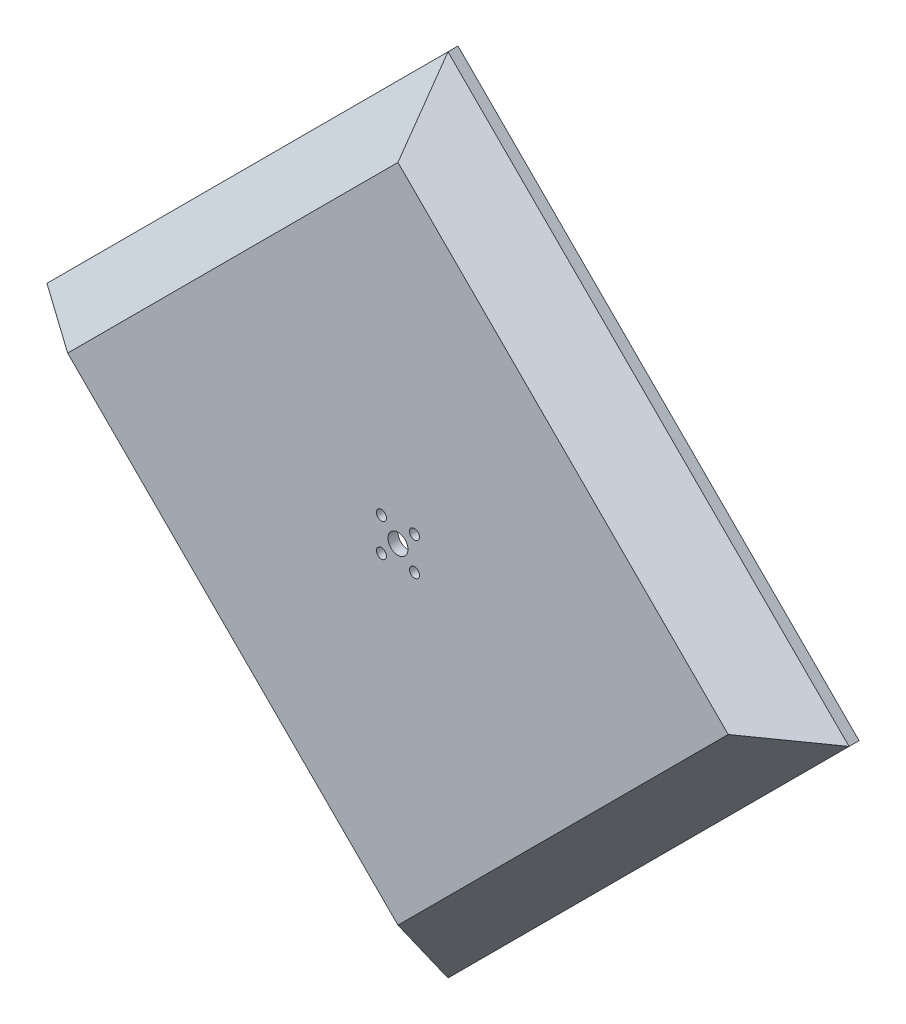
from build123d import *

# Parameters (mm, degrees)
SKETCH_1_W               = 170
SKETCH_1_H               = 170
EXTRUDE_1_DEPTH          = 3
SKETCH_3_R               = 3
SKETCH_3_R_2             = 1.5
CUT_EXTRUDE_1_DEPTH      = 121.245582039
FILLET_1_R               = 2
CUT_EXTRUDE_START        = -10
CUT_EXTRUDE_2_DEPTH      = 10
CUT_EXTRUDE_START_2      = -3
CUT_EXTRUDE_3_DEPTH      = 3
EXTRUDE_4_DEPTH          = 3
EXTRUDE_5_DEPTH          = 170
PATTERN_CIRCULAR_1_COUNT = 4
CUT_EXTRUDE_4_DEPTH      = 179
PATTERN_CIRCULAR_2_COUNT = 4


with BuildPart() as part:
    # 草图1 → 凸台-拉伸1 (new body)
    with BuildSketch(Plane.XY):
        Rectangle(SKETCH_1_W, SKETCH_1_H)
    extrude(amount=EXTRUDE_1_DEPTH)

    # 草图3 → 切除-拉伸1 (cut, through all)
    with BuildSketch(Plane(origin=(0, 0, 0), x_dir=(-1, 0, 0), z_dir=(0, 0, -1))):
        Circle(SKETCH_3_R)
        with Locations((4.95, 4.95)):
            Circle(SKETCH_3_R_2)
        with Locations((-4.95, 4.95)):
            Circle(SKETCH_3_R_2)
        with Locations((-4.95, -4.95)):
            Circle(SKETCH_3_R_2)
        with Locations((4.95, -4.95)):
            Circle(SKETCH_3_R_2)
    extrude(amount=-CUT_EXTRUDE_1_DEPTH, mode=Mode.SUBTRACT)

    # 圆角1
    fillet_1_edges = [part.edges().sort_by_distance(p)[0] for p in [
        (-85, 85, 1.5),
        (85, 85, 1.5),
        (85, -85, 1.5),
        (-85, -85, 1.5),
    ]]
    fillet(fillet_1_edges, radius=FILLET_1_R)

    # 草图4 → 切除-拉伸2 (cut)
    with BuildSketch(Plane(origin=(0, 0, 0), x_dir=(-1, 0, 0), z_dir=(0, 0, -1)).offset(CUT_EXTRUDE_START)):
        with BuildLine():
            Line((-85, 35.208152802), (-60.104076401, 60.104076401))
            Line((-60.104076401, 60.104076401), (-35.208152802, 85))
            Line((-35.208152802, 85), (-83, 85))
            ThreePointArc((-83, 85), (-84.414213562, 84.414213562), (-85, 83))
            Line((-85, 83), (-85, 35.208152802))
        make_face()
        with BuildLine():
            Line((85, -35.208152802), (60.104076401, -60.104076401))
            Line((60.104076401, -60.104076401), (35.208152802, -85))
            Line((35.208152802, -85), (83, -85))
            ThreePointArc((83, -85), (84.414213562, -84.414213562), (85, -83))
            Line((85, -83), (85, -35.208152802))
        make_face()
    extrude(amount=CUT_EXTRUDE_2_DEPTH, mode=Mode.SUBTRACT)

    # 草图6 → 切除-拉伸3 (cut)
    with BuildSketch(Plane(origin=(0, 0, 0), x_dir=(-1, 0, 0), z_dir=(0, 0, -1)).offset(CUT_EXTRUDE_START_2)):
        with BuildLine():
            Line((-35.208152802, -85), (-60.104076401, -60.104076401))
            Line((-60.104076401, -60.104076401), (-85, -35.208152802))
            Line((-85, -35.208152802), (-85, -83))
            ThreePointArc((-85, -83), (-84.414213562, -84.414213562), (-83, -85))
            Line((-83, -85), (-35.208152802, -85))
        make_face()
        with BuildLine():
            Line((35.208152802, 85), (60.104076401, 60.104076401))
            Line((60.104076401, 60.104076401), (85, 35.208152802))
            Line((85, 35.208152802), (85, 83))
            ThreePointArc((85, 83), (84.414213562, 84.414213562), (83, 85))
            Line((83, 85), (35.208152802, 85))
        make_face()
    extrude(amount=CUT_EXTRUDE_3_DEPTH, mode=Mode.SUBTRACT)

    # 草图7 → 凸台-拉伸4 (add)
    with BuildSketch(Plane(origin=(0, 0, 0), x_dir=(-1, 0, 0), z_dir=(0, 0, -1))):
        Polygon((-85, 35.208152802), (-120.208152802, 0), (-85, -35.208152802), align=None)
        Polygon((0, 120.208152802), (-35.208152802, 85), (35.208152802, 85), align=None)
        Polygon((35.208152802, -85), (-35.208152802, -85), (0, -120.208152802), align=None)
        Polygon((120.208152802, 0), (85, 35.208152802), (85, -35.208152802), align=None)
    extrude(amount=-EXTRUDE_4_DEPTH)

    # 草图8 → 凸台-拉伸5 (add)
    with BuildSketch(Plane(origin=(-60.104076401, 60.104076401, 0), x_dir=(0, 0, 1), z_dir=(-0.7071067811865438, 0.7071067811865513, 0))):
        Polygon((0, 73), (-12, 85), (-15, 85), (0, 70), align=None)
    extrude_5 = extrude(amount=-EXTRUDE_5_DEPTH)

    # 阵列(圆周)1: 凸台-拉伸5 ×4 about axis
    pattern_circular_1_axis = Axis((0, 0, 0), (0, 0, 1))
    for i in range(1, PATTERN_CIRCULAR_1_COUNT):
        add(extrude_5.rotate(pattern_circular_1_axis, i * 360 / PATTERN_CIRCULAR_1_COUNT))

    # 草图9 → 切除-拉伸4 (cut)
    with BuildSketch(Plane(origin=(60.104076401, 60.104076401, 0), x_dir=(0, 0, -1), z_dir=(0.7071067811865486, 0.7071067811865465, 0))):
        Polygon((-3, 85), (12, 85), (-3, 70), align=None)
    cut_extrude_4 = extrude(amount=-CUT_EXTRUDE_4_DEPTH, mode=Mode.SUBTRACT)

    # 阵列(圆周)2: 切除-拉伸4 ×4 about axis
    pattern_circular_2_axis = Axis((0, 0, 0), (0, 0, -1))
    for i in range(1, PATTERN_CIRCULAR_2_COUNT):
        add(cut_extrude_4.rotate(pattern_circular_2_axis, i * 360 / PATTERN_CIRCULAR_2_COUNT), mode=Mode.SUBTRACT)


solid = part.part
